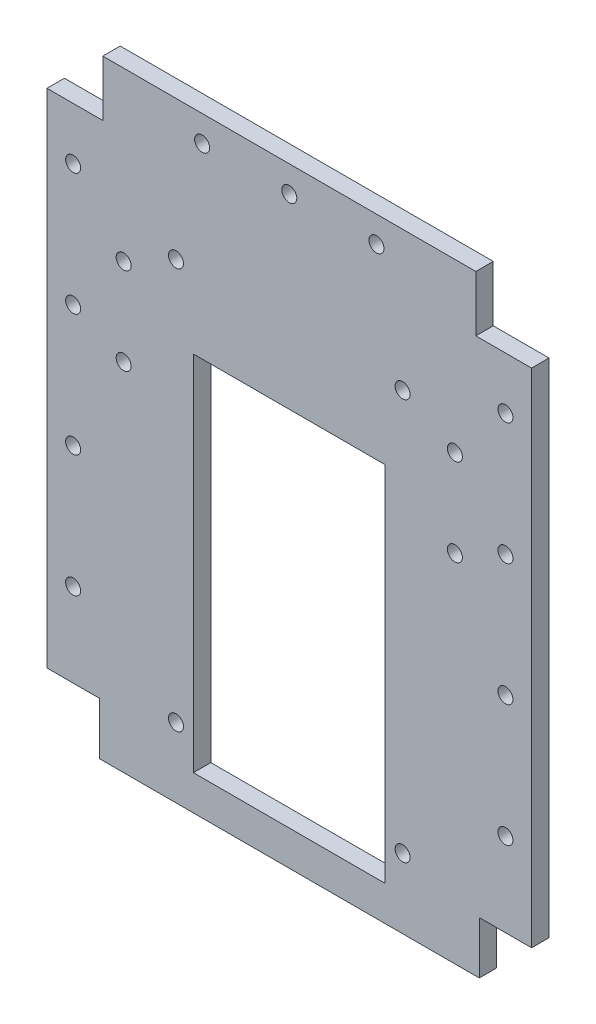
from build123d import *

# Parameters (mm, degrees)
SKETCH1_W           = 139
SKETCH1_H           = 160
BOSS_EXTRUDE1_DEPTH = 5
SKETCH2_W           = 16
SKETCH2_H           = 16
CUT_EXTRUDE1_DEPTH  = 5
SKETCH3_R           = 2.15
CUT_EXTRUDE2_DEPTH  = 5
SKETCH4_R           = 2.15
CUT_EXTRUDE3_DEPTH  = 5
LPATTERN1_COUNT     = 4
LPATTERN1_PITCH     = 35
SKETCH5_R           = 2.15
CUT_EXTRUDE4_DEPTH  = 5
SKETCH6_W           = 109
SKETCH6_H           = 15
BOSS_EXTRUDE2_DEPTH = 5
SKETCH7_W           = 55
SKETCH7_H           = 104
CUT_EXTRUDE5_DEPTH  = 5
SKETCH8_R           = 2.15
CUT_EXTRUDE6_DEPTH  = 5


with BuildPart() as part:
    # Sketch1 → Boss-Extrude1 (new body)
    with BuildSketch(Plane.XY):
        with Locations((69.5, 80)):
            Rectangle(SKETCH1_W, SKETCH1_H)
    extrude(amount=BOSS_EXTRUDE1_DEPTH)

    # Sketch2 → Cut-Extrude1 (cut)
    with BuildSketch(Plane.XY.offset(5)):
        with Locations((131, 152)):
            Rectangle(SKETCH2_W, SKETCH2_H)
        with Locations((8, 152)):
            Rectangle(SKETCH2_W, SKETCH2_H)
    extrude(amount=-CUT_EXTRUDE1_DEPTH, mode=Mode.SUBTRACT)

    # Sketch3 → Cut-Extrude2 (cut)
    with BuildSketch(Plane.XY.offset(5)):
        with Locations((69.5, 152.5)):
            Circle(SKETCH3_R)
        with Locations((44.5, 152.5)):
            Circle(SKETCH3_R)
        with Locations(Location((94.5, 152.5, 0), (0, 0, 180))):
            Circle(SKETCH3_R)
    extrude(amount=-CUT_EXTRUDE2_DEPTH, mode=Mode.SUBTRACT)

    # Sketch4 → Cut-Extrude3 (cut)
    with BuildSketch(Plane.XY.offset(5)):
        with Locations((131.5, 129)):
            Circle(SKETCH4_R)
        with Locations(Location((7.5, 129, 0), (0, 0, 180))):
            Circle(SKETCH4_R)
    cut_extrude3 = extrude(amount=-CUT_EXTRUDE3_DEPTH, mode=Mode.SUBTRACT)

    # LPattern1: Cut-Extrude3 ×4
    with Locations(*[(0, -i * LPATTERN1_PITCH, 0) for i in range(1, LPATTERN1_COUNT)]):
        add(cut_extrude3, mode=Mode.SUBTRACT)

    # Sketch5 → Cut-Extrude4 (cut)
    with BuildSketch(Plane.XY.offset(5)):
        with Locations((117, 112)):
            Circle(SKETCH5_R)
        with Locations((117, 87)):
            Circle(SKETCH5_R)
        with Locations(Location((22, 87, 0), (0, 0, 180))):
            Circle(SKETCH5_R)
        with Locations(Location((22, 112, 0), (0, 0, 180))):
            Circle(SKETCH5_R)
    extrude(amount=-CUT_EXTRUDE4_DEPTH, mode=Mode.SUBTRACT)

    # Sketch6 → Boss-Extrude2 (add)
    with BuildSketch(Plane(origin=(0, 0, 0), x_dir=(-1, 0, 0), z_dir=(0, 0, -1))):
        with Locations((-69.5, -7.5)):
            Rectangle(SKETCH6_W, SKETCH6_H)
    extrude(amount=-BOSS_EXTRUDE2_DEPTH)

    # Sketch7 → Cut-Extrude5 (cut)
    with BuildSketch(Plane.XY.offset(5)):
        with Locations((69.5, 47)):
            Rectangle(SKETCH7_W, SKETCH7_H)
    extrude(amount=-CUT_EXTRUDE5_DEPTH, mode=Mode.SUBTRACT)

    # Sketch8 → Cut-Extrude6 (cut)
    with BuildSketch(Plane.XY.offset(5)):
        with Locations((102, 5)):
            Circle(SKETCH8_R)
        with Locations((102, 120)):
            Circle(SKETCH8_R)
        with Locations(Location((37, 120, 0), (0, 0, 180))):
            Circle(SKETCH8_R)
        with Locations(Location((37, 5, 0), (0, 0, 180))):
            Circle(SKETCH8_R)
    extrude(amount=-CUT_EXTRUDE6_DEPTH, mode=Mode.SUBTRACT)


solid = part.part
